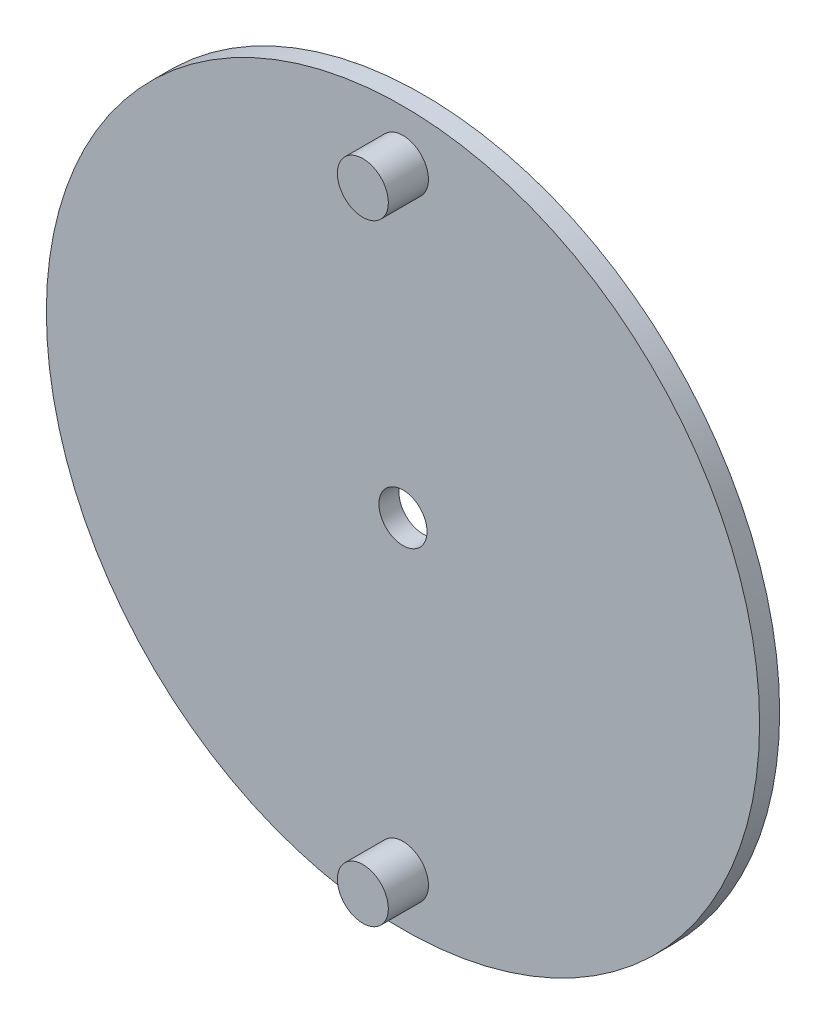
from build123d import *

# Parameters (mm, degrees)
SKETCH1_R           = 88.9
SKETCH1_R_2         = 6
SKETCH1_R_3         = 6.35
BOSS_EXTRUDE1_DEPTH = 5
SKETCH2_R           = 6.35
BOSS_EXTRUDE2_DEPTH = 15


with BuildPart() as part:
    # Sketch1 → Boss-Extrude1 (new body)
    with BuildSketch(Plane.XY):
        Circle(SKETCH1_R)
        Circle(SKETCH1_R_2, mode=Mode.SUBTRACT)
        with Locations((0, -76.2)):
            Circle(SKETCH1_R_3, mode=Mode.SUBTRACT)
        with Locations((0, 76.2)):
            Circle(SKETCH1_R_3, mode=Mode.SUBTRACT)
    extrude(amount=BOSS_EXTRUDE1_DEPTH)

    # Sketch2 → Boss-Extrude2 (add)
    with BuildSketch(Plane.XY):
        with Locations((0, -76.2)):
            Circle(SKETCH2_R)
        with Locations((0, 76.2)):
            Circle(SKETCH2_R)
    extrude(amount=BOSS_EXTRUDE2_DEPTH)


solid = part.part
